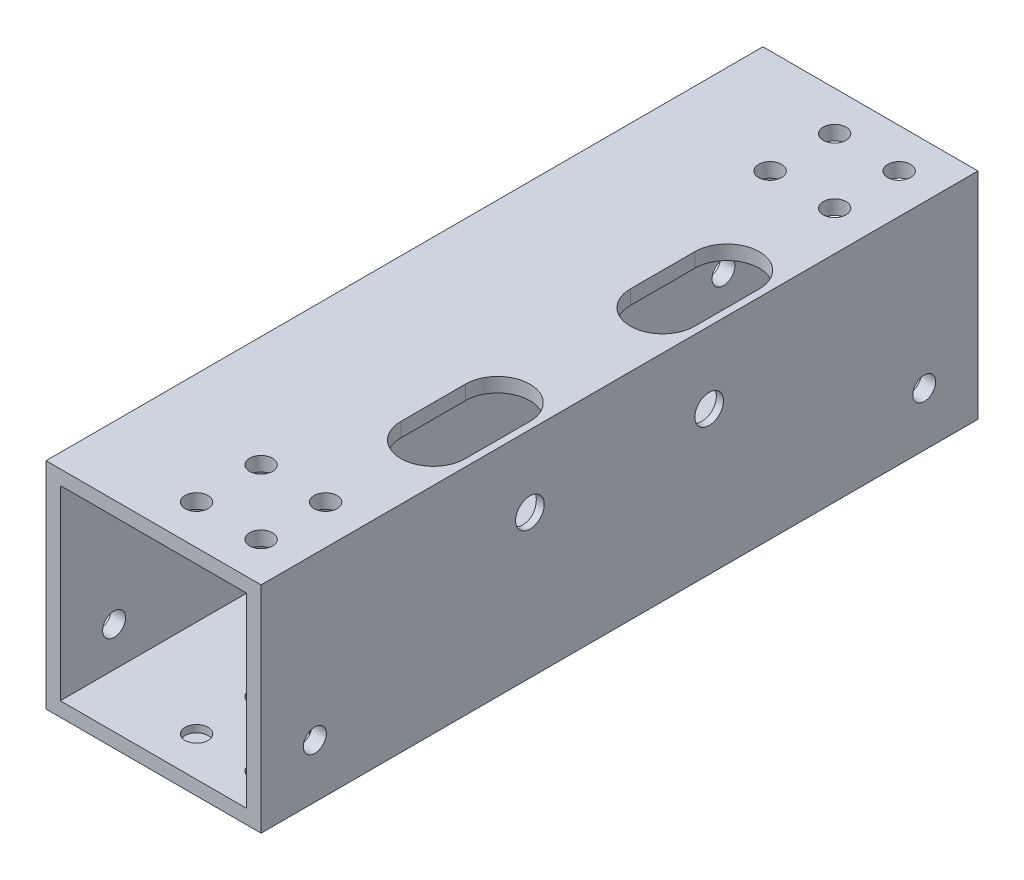
from build123d import *

# Parameters (mm, degrees)
SKETCH_1_W          = 30
SKETCH_1_H          = 30
SKETCH_1_W_2        = 26
SKETCH_1_H_2        = 26
EXTRUDE_1_DEPTH     = 100
SKETCH_3_R          = 1.6
CUT_EXTRUDE_1_DEPTH = 106.475115549
SKETCH_5_R          = 1.6
CUT_EXTRUDE_3_DEPTH = 106.475115549
SKETCH_6_R          = 2
CUT_EXTRUDE_4_DEPTH = 106.475115549
SKETCH_7_W          = 17.574392575
SKETCH_7_H          = 17.83033033
SKETCH_7_W_2        = 16.806579307
SKETCH_7_H_2        = 18.854081354
EXTRUDE_2_DEPTH     = 1
CUT_EXTRUDE_5_REACH = 107.475


with BuildPart() as part:
    # 草图1 → 凸台-拉伸1 (new body)
    with BuildSketch(Plane.XY):
        Rectangle(SKETCH_1_W, SKETCH_1_H)
        Rectangle(SKETCH_1_W_2, SKETCH_1_H_2, mode=Mode.SUBTRACT)
    extrude(amount=EXTRUDE_1_DEPTH)

    # 草图3 → 切除-拉伸1 (cut, through all)
    with BuildSketch(Plane(origin=(0, 15, 0), x_dir=(1, 0, 0), z_dir=(0, 1, 0))):
        with Locations(Location((0.5, -94.5, 0), (0, 0, 270))):
            Circle(SKETCH_3_R)
        with Locations(Location((9.5, -94.5, 0), (0, 0, 270))):
            Circle(SKETCH_3_R)
        with Locations(Location((9.5, -85.5, 0), (0, 0, 270))):
            Circle(SKETCH_3_R)
        with Locations(Location((0.5, -85.5, 0), (0, 0, 270))):
            Circle(SKETCH_3_R)
        with Locations(Location((9.5, -14.5, 0), (0, 0, 270))):
            Circle(SKETCH_3_R)
        with Locations(Location((9.5, -5.5, 0), (0, 0, 270))):
            Circle(SKETCH_3_R)
        with Locations(Location((0.5, -5.5, 0), (0, 0, 270))):
            Circle(SKETCH_3_R)
        with Locations(Location((0.5, -14.5, 0), (0, 0, 270))):
            Circle(SKETCH_3_R)
        with Locations(Location((9.5, -70.5, 0), (0, 0, 270))):
            Circle(SKETCH_3_R)
        with Locations(Location((9.5, -61.5, 0), (0, 0, 270))):
            Circle(SKETCH_3_R)
        with Locations(Location((9.5, -38.5, 0), (0, 0, 270))):
            Circle(SKETCH_3_R)
        with Locations(Location((9.5, -29.5, 0), (0, 0, 270))):
            Circle(SKETCH_3_R)
    extrude(amount=-CUT_EXTRUDE_1_DEPTH, mode=Mode.SUBTRACT)

    # 草图5 → 切除-拉伸3 (cut, through all)
    with BuildSketch(Plane(origin=(15, 0, 0), x_dir=(0, 0, -1), z_dir=(1, 0, 0))):
        with Locations(Location((-92.5, -7.5, 0), (0, 0, 90))):
            Circle(SKETCH_5_R)
        with Locations(Location((-7.5, -7.5, 0), (0, 0, 90))):
            Circle(SKETCH_5_R)
    extrude(amount=-CUT_EXTRUDE_3_DEPTH, mode=Mode.SUBTRACT)

    # 草图6 → 切除-拉伸4 (cut, through all)
    with BuildSketch(Plane(origin=(15, 0, 0), x_dir=(0, 0, -1), z_dir=(1, 0, 0))):
        with Locations(Location((-62.5, 5, 0), (0, 0, 90))):
            Circle(SKETCH_6_R)
        with Locations(Location((-37.5, 5, 0), (0, 0, 90))):
            Circle(SKETCH_6_R)
    extrude(amount=-CUT_EXTRUDE_4_DEPTH, mode=Mode.SUBTRACT)

    # 草图7 → 凸台-拉伸2 (add)
    with BuildSketch(Plane.XZ.offset(15)):
        with Locations((4.265629266, 89.627695878)):
            Rectangle(SKETCH_7_W, SKETCH_7_H)
        with Locations((4.6495359, 10.628241878)):
            Rectangle(SKETCH_7_W_2, SKETCH_7_H_2)
    extrude(amount=-EXTRUDE_2_DEPTH)

    # 草图8 → 切除-拉伸5 (cut, up to next)
    with BuildSketch(Plane.XZ.offset(15), mode=Mode.PRIVATE) as cut_extrude_5_sk1:
        with BuildLine():
            Line((14, 70.5), (14, 61.5))
            ThreePointArc((14, 61.5), (9.5, 57), (5, 61.5))
            Line((5, 61.5), (5, 70.5))
            ThreePointArc((5, 70.5), (9.5, 75), (14, 70.5))
        make_face()
    cut_extrude_5_tool1 = extrude(cut_extrude_5_sk1.sketch, amount=-CUT_EXTRUDE_5_REACH, mode=Mode.PRIVATE) & part.part
    # 草图8 → 切除-拉伸5 (cut, up to next)
    with BuildSketch(Plane.XZ.offset(15), mode=Mode.PRIVATE) as cut_extrude_5_sk2:
        with BuildLine():
            Line((14, 29.5), (14, 38.5))
            ThreePointArc((14, 38.5), (9.5, 43), (5, 38.5))
            Line((5, 38.5), (5, 29.5))
            ThreePointArc((5, 29.5), (9.5, 25), (14, 29.5))
        make_face()
    cut_extrude_5_tool2 = extrude(cut_extrude_5_sk2.sketch, amount=-CUT_EXTRUDE_5_REACH, mode=Mode.PRIVATE) & part.part
    add(cut_extrude_5_tool1.solids().sort_by_distance((9.5, -15, 66))[0], mode=Mode.SUBTRACT)
    add(cut_extrude_5_tool2.solids().sort_by_distance((9.5, -15, 34))[0], mode=Mode.SUBTRACT)


solid = part.part
